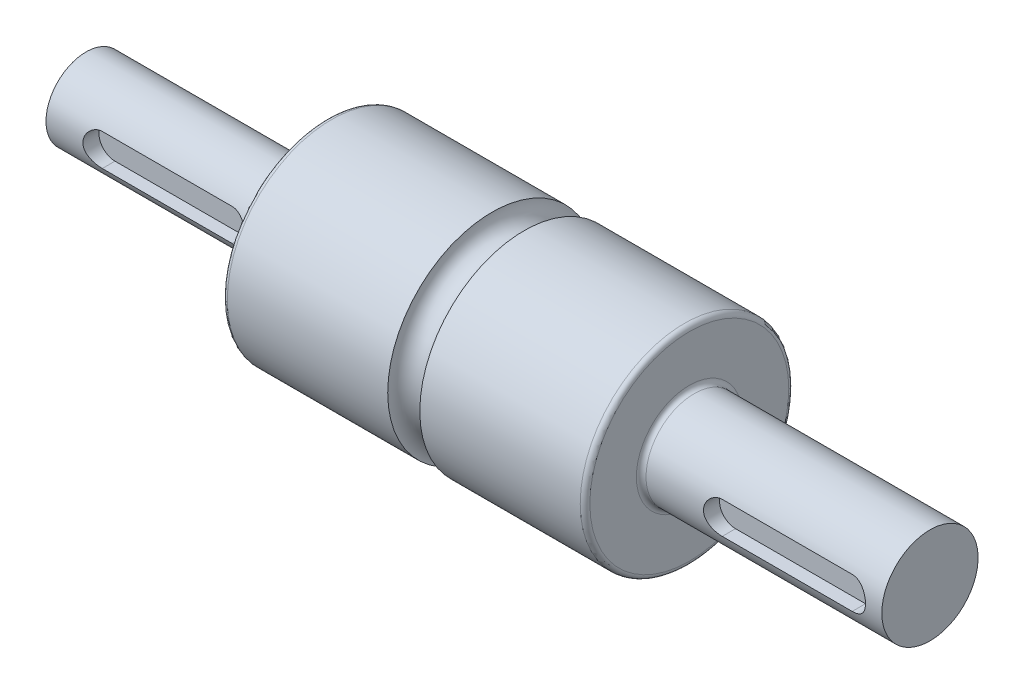
from build123d import *

# Parameters (mm, degrees)
CORTAR_EXTRUIR2_START = 12.5
CORTAR_EXTRUIR2_DEPTH = 5
CORTAR_EXTRUIR3_START = 15
CORTAR_EXTRUIR3_DEPTH = 5


with BuildPart() as part:
    # Croquis4 → Revolución2 (revolve)
    with BuildSketch(Plane(origin=(0, 0, 0), x_dir=(1, 0, 0), z_dir=(0, 1, 0)), mode=Mode.PRIVATE) as revoluci_n2_sk:
        with BuildLine():
            Line((-131.5, 0), (-131.5, 12.5))
            Line((-131.5, 12.5), (-58, 12.5))
            ThreePointArc((-58, 12.5), (-56.939339828, 12.939339828), (-56.5, 14))
            Line((-56.5, 14), (-56.5, 31))
            ThreePointArc((-56.5, 31), (-56.060660172, 32.060660172), (-55, 32.5))
            Line((-55, 32.5), (-5, 32.5))
            ThreePointArc((-5, 32.5), (0, 27.5), (5, 32.5))
            Line((5, 32.5), (55, 32.5))
            ThreePointArc((55, 32.5), (56.060660172, 32.060660172), (56.5, 31))
            Line((56.5, 31), (56.5, 16.5))
            ThreePointArc((56.5, 16.5), (56.939339828, 15.439339828), (58, 15))
            Line((58, 15), (131.5, 15))
            Line((131.5, 15), (131.5, 0))
            Line((131.5, 0), (-131.5, 0))
        make_face()
    revolve(revoluci_n2_sk.sketch.rotate(Axis((-131.5, 0, 0), (1, 0, 0)), 180), axis=Axis((-131.5, 0, 0), (1, 0, 0)))

    # Croquis5 → Cortar-Extruir2 (cut)
    with BuildSketch(Plane.XY.offset(CORTAR_EXTRUIR2_START)):
        with BuildLine():
            Line((-115, -5), (-74.5, -5))
            ThreePointArc((-74.5, -5), (-69.5, 0), (-74.5, 5))
            Line((-74.5, 5), (-115, 5))
            ThreePointArc((-115, 5), (-120, 0), (-115, -5))
        make_face()
    extrude(amount=-CORTAR_EXTRUIR2_DEPTH, mode=Mode.SUBTRACT)

    # Croquis6 → Cortar-Extruir3 (cut)
    with BuildSketch(Plane.XY.offset(CORTAR_EXTRUIR3_START)):
        with BuildLine():
            Line((80.903426942, 5), (121.403426942, 5))
            ThreePointArc((121.403426942, 5), (126.403426942, 0), (121.403426942, -5))
            Line((121.403426942, -5), (80.903426942, -5))
            ThreePointArc((80.903426942, -5), (75.903426942, 0), (80.903426942, 5))
        make_face()
    extrude(amount=-CORTAR_EXTRUIR3_DEPTH, mode=Mode.SUBTRACT)


solid = part.part
